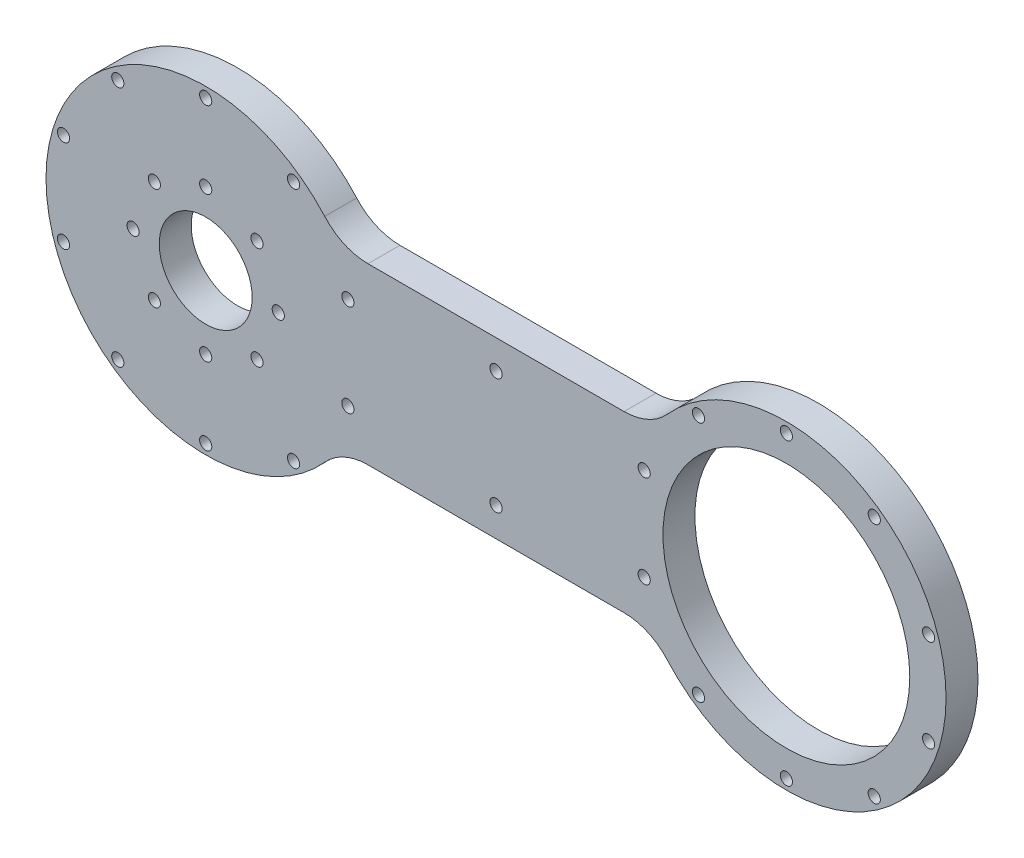
from build123d import *

# Parameters (mm, degrees)
ESQUISSE1_W             = 320
ESQUISSE1_H             = 120
ESQUISSE1_R             = 42.5
ESQUISSE1_R_2           = 16
BOSS_EXTRU_1_DEPTH      = 11
ESQUISSE2_R             = 2.1
ENL_V_MAT_EXTRU_1_DEPTH = 268.05991837
ESQUISSE3_OUTSIDE_W     = 390.388
ESQUISSE3_OUTSIDE_H     = 190.388
ENL_V_MAT_EXTRU_2_DEPTH = 268.05991837
CONG_1_R                = 20
ESQUISSE4_R             = 2.1
ENL_V_MAT_EXTRU_3_DEPTH = 262.095767871
ESQUISSE5_R             = 2.1
ENL_V_MAT_EXTRU_4_DEPTH = 84


with BuildPart() as part:
    # Esquisse1 → Boss.-Extru.1 (new body)
    with BuildSketch(Plane.XY):
        with Locations((-100, 0)):
            Rectangle(ESQUISSE1_W, ESQUISSE1_H)
        Circle(ESQUISSE1_R, mode=Mode.SUBTRACT)
        with Locations((-200, 0)):
            Circle(ESQUISSE1_R_2, mode=Mode.SUBTRACT)
    extrude(amount=BOSS_EXTRU_1_DEPTH)

    # Esquisse2 → Enlèv. mat.-Extru.1 (cut, through all)
    with BuildSketch(Plane.XY.offset(11)):
        with Locations((-200, 25)):
            Circle(ESQUISSE2_R)
        with Locations((-182.32233047, 17.67766953)):
            Circle(ESQUISSE2_R)
        with Locations((-175, 0)):
            Circle(ESQUISSE2_R)
        with Locations((-182.32233047, -17.67766953)):
            Circle(ESQUISSE2_R)
        with Locations((-200, -25)):
            Circle(ESQUISSE2_R)
        with Locations((-217.67766953, -17.67766953)):
            Circle(ESQUISSE2_R)
        with Locations((-225, 0)):
            Circle(ESQUISSE2_R)
        with Locations((-217.67766953, 17.67766953)):
            Circle(ESQUISSE2_R)
    extrude(amount=-ENL_V_MAT_EXTRU_1_DEPTH, mode=Mode.SUBTRACT)

    # Esquisse3 outside → Enlèv. mat.-Extru.2 (cut, through all)
    with BuildSketch(Plane.XY.offset(11)):
        with Locations((-100, 0)):
            Rectangle(ESQUISSE3_OUTSIDE_W, ESQUISSE3_OUTSIDE_H)
        with BuildLine():
            Line((-153.902277714, 30), (-46.097722286, 30))
            ThreePointArc((-46.097722286, 30), (55, 0), (-46.097722286, -30))
            Line((-46.097722286, -30), (-153.902277714, -30))
            ThreePointArc((-153.902277714, -30), (-255, 0), (-153.902277714, 30))
        make_face(mode=Mode.SUBTRACT)
    extrude(amount=-ENL_V_MAT_EXTRU_2_DEPTH, mode=Mode.SUBTRACT)

    # Congé1
    cong_1_edges = [part.edges().sort_by_distance(p)[0] for p in [
        (-153.902277714, 30, 5.5),
        (-46.097722286, 30, 5.5),
        (-46.097722286, -30, 5.5),
        (-153.902277714, -30, 5.5),
    ]]
    fillet(cong_1_edges, radius=CONG_1_R)

    # Esquisse4 → Enlèv. mat.-Extru.3 (cut, through all)
    with BuildSketch(Plane.XY.offset(11)):
        with Locations((-200, 51.5)):
            Circle(ESQUISSE4_R)
        with Locations((-169.729059507, 41.66437521)):
            Circle(ESQUISSE4_R)
        with Locations((-151.020589411, 15.91437521)):
            Circle(ESQUISSE4_R)
        with Locations((-151.020589411, -15.91437521)):
            Circle(ESQUISSE4_R)
        with Locations((-169.729059507, -41.66437521)):
            Circle(ESQUISSE4_R)
        with Locations((-200, -51.5)):
            Circle(ESQUISSE4_R)
        with Locations((-230.270940493, -41.66437521)):
            Circle(ESQUISSE4_R)
        with Locations((-248.979410589, -15.91437521)):
            Circle(ESQUISSE4_R)
        with Locations((-248.979410589, 15.91437521)):
            Circle(ESQUISSE4_R)
        with Locations((-230.270940493, 41.66437521)):
            Circle(ESQUISSE4_R)
        with Locations(Location((30.270940493, 41.66437521, 0), (0, 0, 180))):
            Circle(ESQUISSE4_R)
        with Locations(Location((48.979410589, 15.91437521, 0), (0, 0, 180))):
            Circle(ESQUISSE4_R)
        with Locations(Location((48.979410589, -15.91437521, 0), (0, 0, 180))):
            Circle(ESQUISSE4_R)
        with Locations(Location((30.270940493, -41.66437521, 0), (0, 0, 180))):
            Circle(ESQUISSE4_R)
        with Locations(Location((0, -51.5, 0), (0, 0, 180))):
            Circle(ESQUISSE4_R)
        with Locations(Location((-30.270940493, -41.66437521, 0), (0, 0, 180))):
            Circle(ESQUISSE4_R)
        with Locations(Location((-48.979410589, -15.91437521, 0), (0, 0, 180))):
            Circle(ESQUISSE4_R)
        with Locations(Location((-48.979410589, 15.91437521, 0), (0, 0, 180))):
            Circle(ESQUISSE4_R)
        with Locations(Location((-30.270940493, 41.66437521, 0), (0, 0, 180))):
            Circle(ESQUISSE4_R)
        with Locations(Location((0, 51.5, 0), (0, 0, 180))):
            Circle(ESQUISSE4_R)
    extrude(amount=-ENL_V_MAT_EXTRU_3_DEPTH, mode=Mode.SUBTRACT)

    # Esquisse5 → Enlèv. mat.-Extru.4 (cut)
    with BuildSketch(Plane.XY.offset(11)):
        with Locations((-100, 20)):
            Circle(ESQUISSE5_R)
        with Locations((-100, -20)):
            Circle(ESQUISSE5_R)
    extrude(amount=-ENL_V_MAT_EXTRU_4_DEPTH, mode=Mode.SUBTRACT)


solid = part.part
